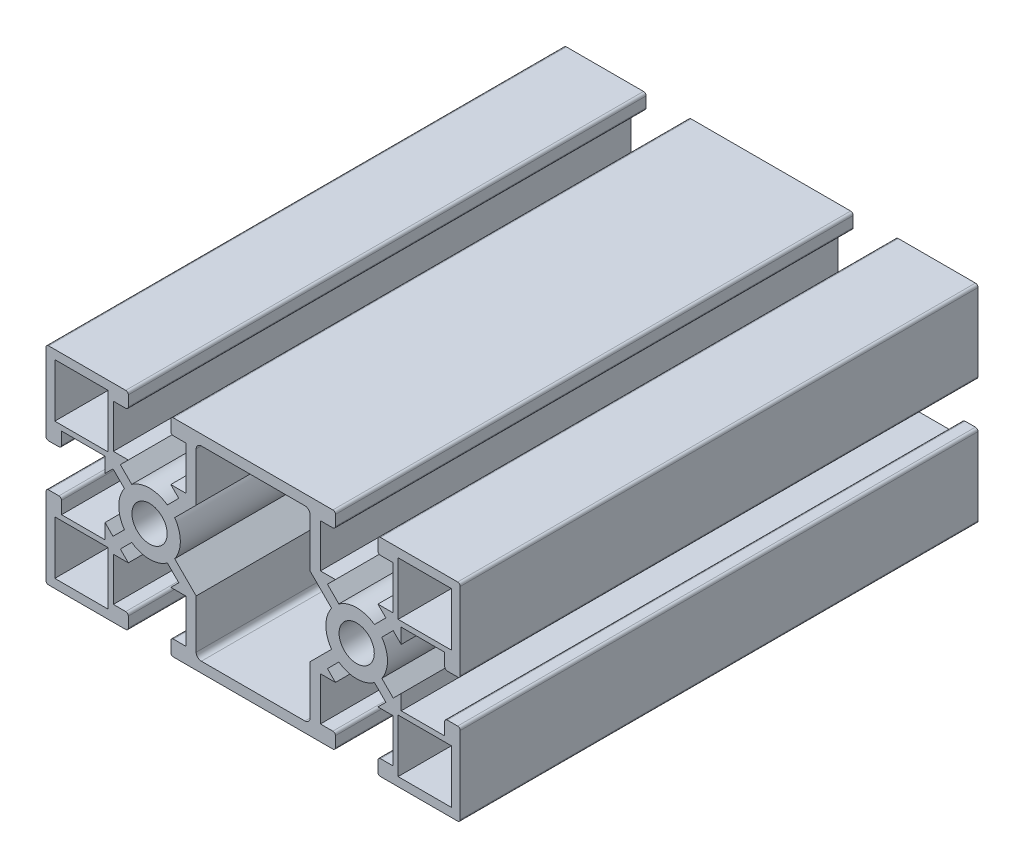
from build123d import *

# Parameters (mm, degrees)
SKETCH_1_R      = 3.4
SKETCH_1_W      = 10.3
SKETCH_1_H      = 10.3
EXTRUDE_1_DEPTH = 100


with BuildPart() as part:
    # 草图1 → 凸台-拉伸1 (new body)
    with BuildSketch(Plane.XY):
        with BuildLine():
            Line((-22.463172707, 9.357012623), (-25.363172707, 9.357012623))
            Line((-25.363172707, 9.357012623), (-25.363172707, 17.757012623))
            Line((-25.363172707, 17.757012623), (-22.963172707, 17.757012623))
            ThreePointArc((-22.963172707, 17.757012623), (-22.609619316, 17.903459232), (-22.463172707, 18.257012623))
            Line((-22.463172707, 18.257012623), (-22.463172707, 20.257012623))
            ThreePointArc((-22.463172707, 20.257012623), (-22.609619316, 20.610566013), (-22.963172707, 20.757012623))
            Line((-22.963172707, 20.757012623), (-37.863172707, 20.757012623))
            ThreePointArc((-37.863172707, 20.757012623), (-38.216726098, 20.610566013), (-38.363172707, 20.257012623))
            Line((-38.363172707, 20.257012623), (-38.363172707, 5.357012623))
            ThreePointArc((-38.363172707, 5.357012623), (-38.216726098, 5.003459232), (-37.863172707, 4.857012623))
            Line((-37.863172707, 4.857012623), (-35.863172707, 4.857012623))
            ThreePointArc((-35.863172707, 4.857012623), (-35.509619316, 5.003459232), (-35.363172707, 5.357012623))
            Line((-35.363172707, 5.357012623), (-35.363172707, 7.757012623))
            Line((-35.363172707, 7.757012623), (-26.963172707, 7.757012623))
            Line((-26.963172707, 7.757012623), (-26.963172707, 4.857012623))
            Line((-26.963172707, 4.857012623), (-25.420279488, 6.399905842))
            Line((-25.420279488, 6.399905842), (-23.217718457, 4.19734481))
            ThreePointArc((-23.217718457, 4.19734481), (-24.313172707, 0.757012623), (-23.217718457, -2.683319565))
            Line((-23.217718457, -2.683319565), (-25.420279488, -4.885880596))
            Line((-25.420279488, -4.885880596), (-26.963172707, -3.342987377))
            Line((-26.963172707, -3.342987377), (-26.963172707, -6.242987377))
            Line((-26.963172707, -6.242987377), (-35.363172707, -6.242987377))
            Line((-35.363172707, -6.242987377), (-35.363172707, -3.842987377))
            ThreePointArc((-35.363172707, -3.842987377), (-35.509619316, -3.489433987), (-35.863172707, -3.342987377))
            Line((-35.863172707, -3.342987377), (-37.863172707, -3.342987377))
            ThreePointArc((-37.863172707, -3.342987377), (-38.216726098, -3.489433987), (-38.363172707, -3.842987377))
            Line((-38.363172707, -3.842987377), (-38.363172707, -18.742987377))
            ThreePointArc((-38.363172707, -18.742987377), (-38.216726098, -19.096540768), (-37.863172707, -19.242987377))
            Line((-37.863172707, -19.242987377), (-22.963172707, -19.242987377))
            ThreePointArc((-22.963172707, -19.242987377), (-22.609619316, -19.096540768), (-22.463172707, -18.742987377))
            Line((-22.463172707, -18.742987377), (-22.463172707, -16.742987377))
            ThreePointArc((-22.463172707, -16.742987377), (-22.609619316, -16.389433987), (-22.963172707, -16.242987377))
            Line((-22.963172707, -16.242987377), (-25.363172707, -16.242987377))
            Line((-25.363172707, -16.242987377), (-25.363172707, -7.842987377))
            Line((-25.363172707, -7.842987377), (-22.463172707, -7.842987377))
            Line((-22.463172707, -7.842987377), (-24.006065926, -6.300094158))
            Line((-24.006065926, -6.300094158), (-21.803504895, -4.097533127))
            ThreePointArc((-21.803504895, -4.097533127), (-18.363172707, -5.192987377), (-14.922840519, -4.097533127))
            Line((-14.922840519, -4.097533127), (-12.720279488, -6.300094158))
            Line((-12.720279488, -6.300094158), (-14.263172707, -7.842987377))
            Line((-14.263172707, -7.842987377), (-11.363172707, -7.842987377))
            Line((-11.363172707, -7.842987377), (-11.363172707, -16.242987377))
            Line((-11.363172707, -16.242987377), (-13.763172707, -16.242987377))
            ThreePointArc((-13.763172707, -16.242987377), (-14.116726098, -16.389433987), (-14.263172707, -16.742987377))
            Line((-14.263172707, -16.742987377), (-14.263172707, -18.742987377))
            ThreePointArc((-14.263172707, -18.742987377), (-14.116726098, -19.096540768), (-13.763172707, -19.242987377))
            Line((-13.763172707, -19.242987377), (1.136827293, -19.242987377))
            Line((1.136827293, -19.242987377), (2.136827293, -19.242987377))
            Line((2.136827293, -19.242987377), (17.036827293, -19.242987377))
            ThreePointArc((17.036827293, -19.242987377), (17.390380684, -19.096540768), (17.536827293, -18.742987377))
            Line((17.536827293, -18.742987377), (17.536827293, -16.742987377))
            ThreePointArc((17.536827293, -16.742987377), (17.390380684, -16.389433987), (17.036827293, -16.242987377))
            Line((17.036827293, -16.242987377), (14.636827293, -16.242987377))
            Line((14.636827293, -16.242987377), (14.636827293, -7.842987377))
            Line((14.636827293, -7.842987377), (17.536827293, -7.842987377))
            Line((17.536827293, -7.842987377), (15.993934074, -6.300094158))
            Line((15.993934074, -6.300094158), (18.196495105, -4.097533127))
            ThreePointArc((18.196495105, -4.097533127), (21.636827293, -5.192987377), (25.077159481, -4.097533127))
            Line((25.077159481, -4.097533127), (27.279720512, -6.300094158))
            Line((27.279720512, -6.300094158), (25.736827293, -7.842987377))
            Line((25.736827293, -7.842987377), (28.636827293, -7.842987377))
            Line((28.636827293, -7.842987377), (28.636827293, -16.242987377))
            Line((28.636827293, -16.242987377), (26.236827293, -16.242987377))
            ThreePointArc((26.236827293, -16.242987377), (25.883273902, -16.389433987), (25.736827293, -16.742987377))
            Line((25.736827293, -16.742987377), (25.736827293, -18.742987377))
            ThreePointArc((25.736827293, -18.742987377), (25.883273902, -19.096540768), (26.236827293, -19.242987377))
            Line((26.236827293, -19.242987377), (41.136827293, -19.242987377))
            ThreePointArc((41.136827293, -19.242987377), (41.490380684, -19.096540768), (41.636827293, -18.742987377))
            Line((41.636827293, -18.742987377), (41.636827293, -3.842987377))
            ThreePointArc((41.636827293, -3.842987377), (41.490380684, -3.489433987), (41.136827293, -3.342987377))
            Line((41.136827293, -3.342987377), (39.136827293, -3.342987377))
            ThreePointArc((39.136827293, -3.342987377), (38.783273902, -3.489433987), (38.636827293, -3.842987377))
            Line((38.636827293, -3.842987377), (38.636827293, -6.242987377))
            Line((38.636827293, -6.242987377), (30.236827293, -6.242987377))
            Line((30.236827293, -6.242987377), (30.236827293, -3.342987377))
            Line((30.236827293, -3.342987377), (28.693934074, -4.885880596))
            Line((28.693934074, -4.885880596), (26.491373043, -2.683319565))
            ThreePointArc((26.491373043, -2.683319565), (27.586827293, 0.757012623), (26.491373043, 4.19734481))
            Line((26.491373043, 4.19734481), (28.693934074, 6.399905842))
            Line((28.693934074, 6.399905842), (30.236827293, 4.857012623))
            Line((30.236827293, 4.857012623), (30.236827293, 7.757012623))
            Line((30.236827293, 7.757012623), (38.636827293, 7.757012623))
            Line((38.636827293, 7.757012623), (38.636827293, 5.357012623))
            ThreePointArc((38.636827293, 5.357012623), (38.783273902, 5.003459232), (39.136827293, 4.857012623))
            Line((39.136827293, 4.857012623), (41.136827293, 4.857012623))
            ThreePointArc((41.136827293, 4.857012623), (41.490380684, 5.003459232), (41.636827293, 5.357012623))
            Line((41.636827293, 5.357012623), (41.636827293, 20.257012623))
            ThreePointArc((41.636827293, 20.257012623), (41.490380684, 20.610566013), (41.136827293, 20.757012623))
            Line((41.136827293, 20.757012623), (26.236827293, 20.757012623))
            ThreePointArc((26.236827293, 20.757012623), (25.883273902, 20.610566013), (25.736827293, 20.257012623))
            Line((25.736827293, 20.257012623), (25.736827293, 18.257012623))
            ThreePointArc((25.736827293, 18.257012623), (25.883273902, 17.903459232), (26.236827293, 17.757012623))
            Line((26.236827293, 17.757012623), (28.636827293, 17.757012623))
            Line((28.636827293, 17.757012623), (28.636827293, 9.357012623))
            Line((28.636827293, 9.357012623), (25.736827293, 9.357012623))
            Line((25.736827293, 9.357012623), (27.279720512, 7.814119404))
            Line((27.279720512, 7.814119404), (25.077159481, 5.611558373))
            ThreePointArc((25.077159481, 5.611558373), (21.636827293, 6.707012623), (18.196495105, 5.611558373))
            Line((18.196495105, 5.611558373), (15.993934074, 7.814119404))
            Line((15.993934074, 7.814119404), (17.536827293, 9.357012623))
            Line((17.536827293, 9.357012623), (14.636827293, 9.357012623))
            Line((14.636827293, 9.357012623), (14.636827293, 17.757012623))
            Line((14.636827293, 17.757012623), (17.036827293, 17.757012623))
            ThreePointArc((17.036827293, 17.757012623), (17.390380684, 17.903459232), (17.536827293, 18.257012623))
            Line((17.536827293, 18.257012623), (17.536827293, 20.257012623))
            ThreePointArc((17.536827293, 20.257012623), (17.390380684, 20.610566013), (17.036827293, 20.757012623))
            Line((17.036827293, 20.757012623), (2.136827293, 20.757012623))
            Line((2.136827293, 20.757012623), (1.136827293, 20.757012623))
            Line((1.136827293, 20.757012623), (-13.763172707, 20.757012623))
            ThreePointArc((-13.763172707, 20.757012623), (-14.116726098, 20.610566013), (-14.263172707, 20.257012623))
            Line((-14.263172707, 20.257012623), (-14.263172707, 18.257012623))
            ThreePointArc((-14.263172707, 18.257012623), (-14.116726098, 17.903459232), (-13.763172707, 17.757012623))
            Line((-13.763172707, 17.757012623), (-11.363172707, 17.757012623))
            Line((-11.363172707, 17.757012623), (-11.363172707, 9.357012623))
            Line((-11.363172707, 9.357012623), (-14.263172707, 9.357012623))
            Line((-14.263172707, 9.357012623), (-12.720279488, 7.814119404))
            Line((-12.720279488, 7.814119404), (-14.922840519, 5.611558373))
            ThreePointArc((-14.922840519, 5.611558373), (-18.363172707, 6.707012623), (-21.803504895, 5.611558373))
            Line((-21.803504895, 5.611558373), (-24.006065926, 7.814119404))
            Line((-24.006065926, 7.814119404), (-22.463172707, 9.357012623))
        make_face()
        with Locations((-18.363172707, 0.757012623)):
            Circle(SKETCH_1_R, mode=Mode.SUBTRACT)
        with Locations((21.636827293, 0.757012623)):
            Circle(SKETCH_1_R, mode=Mode.SUBTRACT)
        with Locations((-31.513172707, 13.907012623)):
            Rectangle(SKETCH_1_W, SKETCH_1_H, mode=Mode.SUBTRACT)
        with BuildLine():
            Line((-9.363172707, 17.757012623), (-9.363172707, 8.34279906))
            Line((-9.363172707, 8.34279906), (-13.508626957, 4.19734481))
            ThreePointArc((-13.508626957, 4.19734481), (-12.413172707, 0.757012623), (-13.508626957, -2.683319565))
            Line((-13.508626957, -2.683319565), (-9.363172707, -6.828773815))
            Line((-9.363172707, -6.828773815), (-9.363172707, -16.242987377))
            ThreePointArc((-9.363172707, -16.242987377), (-9.070279488, -16.950094158), (-8.363172707, -17.242987377))
            Line((-8.363172707, -17.242987377), (11.636827293, -17.242987377))
            ThreePointArc((11.636827293, -17.242987377), (12.343934074, -16.950094158), (12.636827293, -16.242987377))
            Line((12.636827293, -16.242987377), (12.636827293, -6.828773815))
            Line((12.636827293, -6.828773815), (16.782281543, -2.683319565))
            ThreePointArc((16.782281543, -2.683319565), (15.686827293, 0.757012623), (16.782281543, 4.19734481))
            Line((16.782281543, 4.19734481), (12.636827293, 8.34279906))
            Line((12.636827293, 8.34279906), (12.636827293, 17.757012623))
            ThreePointArc((12.636827293, 17.757012623), (12.343934074, 18.464119404), (11.636827293, 18.757012623))
            Line((11.636827293, 18.757012623), (-8.363172707, 18.757012623))
            ThreePointArc((-8.363172707, 18.757012623), (-9.070279488, 18.464119404), (-9.363172707, 17.757012623))
        make_face(mode=Mode.SUBTRACT)
        with Locations((-31.513172707, -12.392987377)):
            Rectangle(SKETCH_1_W, SKETCH_1_H, mode=Mode.SUBTRACT)
        with Locations((34.786827293, 13.907012623)):
            Rectangle(SKETCH_1_W, SKETCH_1_H, mode=Mode.SUBTRACT)
        with Locations((34.786827293, -12.392987377)):
            Rectangle(SKETCH_1_W, SKETCH_1_H, mode=Mode.SUBTRACT)
    extrude(amount=EXTRUDE_1_DEPTH)


solid = part.part
